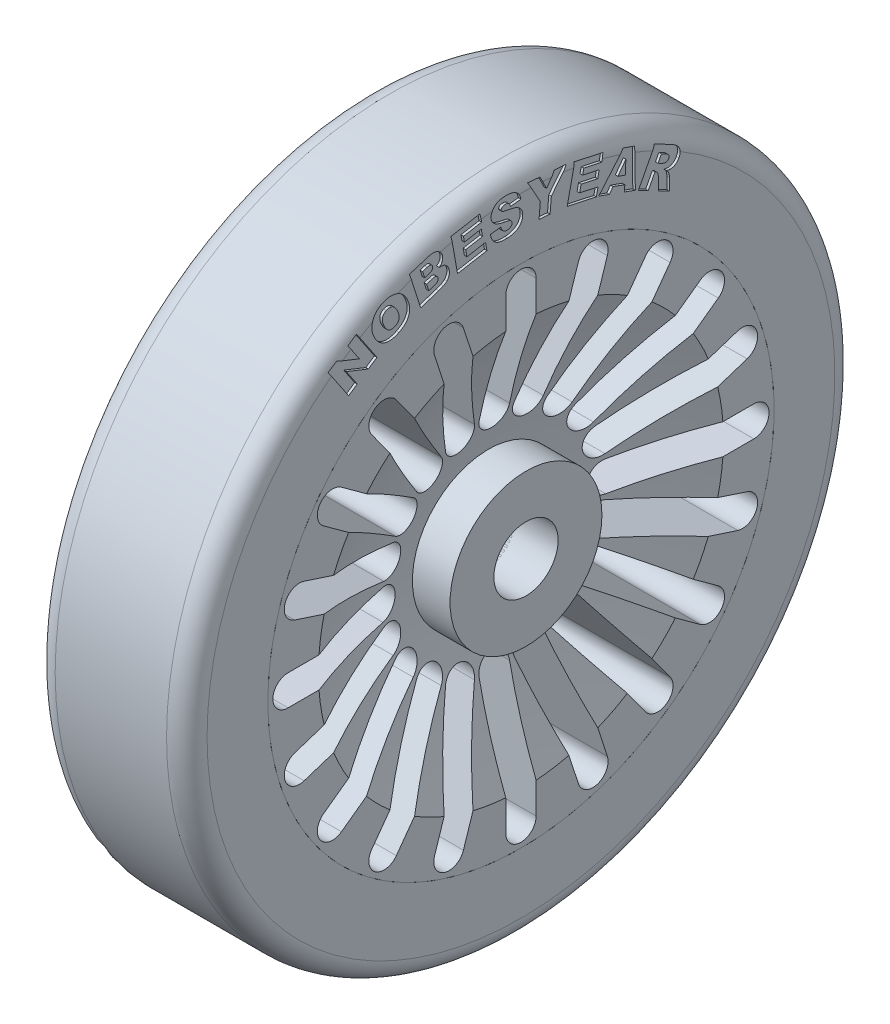
from build123d import *

# Parameters (mm, degrees)
SKETCH2_W           = 15
SKETCH2_H           = 8
FILLET1_R           = 2
SKETCH3_R           = 7.5
BOSS_EXTRUDE1_DEPTH = 8
SKETCH4_R           = 3.175
AXEL_HOLE_DEPTH     = 50.335585601
SPOKE_HOLE_DEPTH    = 48.349762477
CIRPATTERN1_COUNT   = 20
NAME_PLATE_DEPTH    = 0.25


with BuildPart() as part:
    # Sketch1 → Hub (revolve)
    with BuildSketch(Plane.XY):
        with BuildLine():
            Line((-3.75, 0), (3.75, 0))
            ThreePointArc((3.75, 0), (4.695598013, 10.174262873), (7.5, 20))
            Line((7.5, 20), (7.5, 25))
            Line((7.5, 25), (-7.5, 25))
            Line((-7.5, 25), (-7.5, 20))
            ThreePointArc((-7.5, 20), (-4.695598013, 10.174262873), (-3.75, 0))
        make_face()
    revolve(axis=Axis((-3.75, 0, 0), (1, 0, 0)))


with BuildPart() as body_2:
    # Sketch2 → Tire (revolve)
    with BuildSketch(Plane.XY, mode=Mode.PRIVATE) as tire_sk:
        with Locations((0, 29)):
            Rectangle(SKETCH2_W, SKETCH2_H)
    revolve(tire_sk.sketch.rotate(Axis((-1.5, 0, 0), (1, 0, 0)), 90), axis=Axis((-1.5, 0, 0), (1, 0, 0)))

    # Fillet1
    fillet1_edges = [body_2.edges().sort_by_distance(p)[0] for p in [
        (-7.5, 0, -33),
        (7.5, 0, -33),
    ]]
    fillet(fillet1_edges, radius=FILLET1_R)

    # Sketch6 → NAME PLATE (cut)
    # profile 1 of 9: a face of its own
    with BuildSketch(Plane(origin=(7.5, 0, 0), x_dir=(0, 0, -1), z_dir=(1, 0, 0))):
        Polygon((-18.993375251, 25.131214643), (-18.148204796, 25.700816915), (-15.952892296, 24.825106688), (-17.045221842, 26.445135097), (-16.192949114, 27.019708961), (-14.218517296, 24.091441915), (-15.070790023, 23.516868052), (-17.252608205, 24.384765779), (-16.16809116, 22.776811233), (-17.018943432, 22.202947597), align=None)
    # profile 2 of 9: a face of its own
    with BuildSketch(Plane(origin=(7.5, 0, 0), x_dir=(0, 0, -1), z_dir=(1, 0, 0))):
        with BuildLine():
            add(Edge.make_bspline(
                [(-14.495635258, 25.957333021), (-14.524596303, 26.020589457), (-14.581028049, 26.143847135), (-14.646506245, 26.331312387), (-14.693395657, 26.51475838), (-14.721109606, 26.694119267), (-14.731891855, 26.869219222), (-14.722710466, 27.040354689), (-14.693900257, 27.206982002), (-14.647855675, 27.369175888), (-14.583050319, 27.524329118), (-14.501536683, 27.672316029), (-14.401762005, 27.810938369), (-14.286497521, 27.942670247), (-14.152224142, 28.064159328), (-14.001879046, 28.177684617), (-13.834955016, 28.283854344), (-13.714486379, 28.344500075), (-13.652595485, 28.375656885)],
                knots=[0, 0, 0, 0, 1.147556844, 2.236060119, 3.271688379, 4.267888835, 5.226584, 6.161657968, 7.089078349, 8.011532036, 8.938013924, 9.857799998, 10.793330865, 11.751062409, 12.741000169, 13.775500434, 14.857160916, 16, 16, 16, 16], degree=3))
            add(Edge.make_bspline(
                [(-13.652595485, 28.375656885), (-13.588153108, 28.405088211), (-13.462728641, 28.462370524), (-13.272346669, 28.52911549), (-13.087164353, 28.578079959), (-12.906739334, 28.608648541), (-12.731031041, 28.619467165), (-12.560273136, 28.611830028), (-12.394282375, 28.585714388), (-12.234008297, 28.539850106), (-12.080483536, 28.476470656), (-11.934075203, 28.396493705), (-11.796874794, 28.298122661), (-11.666519863, 28.184297125), (-11.546714091, 28.051469993), (-11.433955718, 27.902856338), (-11.329308463, 27.737239922), (-11.268814833, 27.617903324), (-11.237822758, 27.556764839)],
                knots=[0, 0, 0, 0, 1.171891098, 2.280856497, 3.333726478, 4.338475981, 5.304026371, 6.241353904, 7.161752559, 8.078207226, 8.993455259, 9.905200075, 10.832452066, 11.781835806, 12.763505498, 13.786834529, 14.866151835, 16, 16, 16, 16], degree=3))
            add(Edge.make_bspline(
                [(-11.237822758, 27.556764839), (-11.216776094, 27.511506839), (-11.175519812, 27.42279079), (-11.122557619, 27.289193645), (-11.077445765, 27.1594792), (-11.041636142, 27.03284113), (-11.014466268, 26.909801214), (-10.996624844, 26.789937684), (-10.987198814, 26.673669281), (-10.986240898, 26.560640539), (-10.994493385, 26.450568799), (-11.009144918, 26.342997438), (-11.031812155, 26.237765575), (-11.062771529, 26.135161842), (-11.100158883, 26.034768394), (-11.145984884, 25.937045079), (-11.199525925, 25.841869025), (-11.259887269, 25.748619972), (-11.327869571, 25.658113998), (-11.405463414, 25.57206071), (-11.490397415, 25.488695034), (-11.584949601, 25.410205663), (-11.686619175, 25.333597175), (-11.797397772, 25.26162547), (-11.916561746, 25.193124035), (-11.999918502, 25.151292423), (-12.042510258, 25.129918249)],
                knots=[0, 0, 0, 0, 1.233425831, 2.417797208, 3.550282353, 4.626511627, 5.668653415, 6.66251431, 7.619322052, 8.549713982, 9.453126324, 10.345192288, 11.231211845, 12.110579057, 12.991988033, 13.87678948, 14.77533758, 15.689094136, 16.620644563, 17.569673324, 18.550355677, 19.55953236, 20.6045941, 21.695218295, 22.822354601, 24, 24, 24, 24], degree=3))
            add(Edge.make_bspline(
                [(-12.042510258, 25.129918249), (-12.086354926, 25.109367108), (-12.172042812, 25.069202959), (-12.301128787, 25.017397873), (-12.4267267, 24.973324492), (-12.549097186, 24.936558274), (-12.668492046, 24.908998922), (-12.784658408, 24.888844936), (-12.897563495, 24.876495568), (-13.007740178, 24.872749446), (-13.115753601, 24.8779365), (-13.222332822, 24.890700222), (-13.327846714, 24.911183315), (-13.432055276, 24.94058221), (-13.53497105, 24.978373512), (-13.636760317, 25.023969669), (-13.73737554, 25.077581326), (-13.836568168, 25.139133283), (-13.93343685, 25.209291557), (-14.025935439, 25.289495668), (-14.114897383, 25.378331476), (-14.199280297, 25.476653015), (-14.279753146, 25.583761706), (-14.356498603, 25.699642031), (-14.428917054, 25.824838306), (-14.473107328, 25.912595131), (-14.495635258, 25.957333021)],
                knots=[0, 0, 0, 0, 1.180994642, 2.308078441, 3.391145699, 4.427187976, 5.423184236, 6.378293821, 7.30174956, 8.191565589, 9.064524542, 9.936986702, 10.80793764, 11.683700077, 12.575257229, 13.480014828, 14.402314169, 15.354205886, 16.325656927, 17.316600957, 18.337483392, 19.389814632, 20.474358926, 21.60355643, 22.77830781, 24, 24, 24, 24], degree=3))
        make_face()
        with BuildLine():
            add(Edge.make_bspline(
                [(-13.518362531, 26.422531885), (-13.499368051, 26.384429117), (-13.462669583, 26.310812293), (-13.402715461, 26.207795241), (-13.342434216, 26.114897637), (-13.278614782, 26.034613369), (-13.214834226, 25.963960621), (-13.148805142, 25.905059063), (-13.081684256, 25.856194906), (-13.011871168, 25.820065683), (-12.941599213, 25.792754907), (-12.870192167, 25.775077666), (-12.798075575, 25.764518833), (-12.724860101, 25.764416504), (-12.650778688, 25.771365384), (-12.576067899, 25.787326062), (-12.500295977, 25.811395635), (-12.4511576, 25.833708481), (-12.426032985, 25.845117112)],
                knots=[0, 0, 0, 0, 1.451753448, 2.804874346, 4.063503266, 5.224980128, 6.299380172, 7.305912841, 8.238015884, 9.122931422, 9.979200078, 10.803697263, 11.627046977, 12.458787784, 13.294399992, 14.160661689, 15.059540244, 16, 16, 16, 16], degree=3))
            add(Edge.make_bspline(
                [(-12.426032985, 25.845117112), (-12.400933697, 25.857938744), (-12.351907486, 25.882983119), (-12.284007342, 25.927063436), (-12.224297427, 25.976227262), (-12.171820897, 26.029213825), (-12.126631359, 26.086158142), (-12.089568526, 26.147904263), (-12.059436252, 26.213546744), (-12.037072522, 26.284284316), (-12.023204468, 26.361095947), (-12.021157297, 26.445169149), (-12.0286034, 26.536260885), (-12.046040844, 26.634889483), (-12.074215074, 26.740923145), (-12.11298955, 26.854331423), (-12.161466017, 26.975422575), (-12.199540919, 27.057415706), (-12.219356849, 27.100088703)],
                knots=[0, 0, 0, 0, 0.928673853, 1.813970169, 2.662310032, 3.47351134, 4.268177454, 5.052467934, 5.841712529, 6.643854069, 7.49194263, 8.405541969, 9.407495453, 10.500610212, 11.70257545, 13.020409, 14.449283786, 16, 16, 16, 16], degree=3))
            add(Edge.make_bspline(
                [(-12.219356849, 27.100088703), (-12.237111081, 27.13585639), (-12.271389087, 27.20491288), (-12.328754093, 27.300823053), (-12.38664695, 27.387616977), (-12.447651501, 27.46351576), (-12.510410215, 27.529575442), (-12.575019089, 27.585553654), (-12.642337829, 27.630767274), (-12.711622216, 27.665884314), (-12.782432534, 27.691170515), (-12.85366271, 27.709706561), (-12.926038024, 27.71772445), (-12.999159019, 27.718795239), (-13.073151912, 27.710475083), (-13.148313168, 27.695113727), (-13.223961634, 27.669667379), (-13.273506755, 27.647614189), (-13.298902303, 27.636310294)],
                knots=[0, 0, 0, 0, 1.397080101, 2.697335408, 3.90846876, 5.045935185, 6.100820458, 7.093921255, 8.03154869, 8.932010844, 9.804868264, 10.658960914, 11.501724501, 12.346928528, 13.213470536, 14.102383644, 15.027330889, 16, 16, 16, 16], degree=3))
            add(Edge.make_bspline(
                [(-13.298902303, 27.636310294), (-13.322603701, 27.624227659), (-13.369135279, 27.600506523), (-13.43319581, 27.557640624), (-13.490555379, 27.509970612), (-13.540400178, 27.4569165), (-13.58421278, 27.399719572), (-13.621423093, 27.337650763), (-13.651155434, 27.270554355), (-13.674204896, 27.198749537), (-13.689437902, 27.121597862), (-13.694048936, 27.03851107), (-13.688466454, 26.949788526), (-13.674172533, 26.855163046), (-13.649610207, 26.754752494), (-13.614959193, 26.648945164), (-13.571636416, 26.536886328), (-13.536577904, 26.461631884), (-13.518362531, 26.422531885)],
                knots=[0, 0, 0, 0, 0.910332452, 1.787202857, 2.633136858, 3.458903744, 4.274460508, 5.09611858, 5.930751315, 6.781913036, 7.673830934, 8.615915255, 9.622742753, 10.713052165, 11.888854681, 13.15787868, 14.523317198, 16, 16, 16, 16], degree=3))
        make_face(mode=Mode.SUBTRACT)
    # profile 3 of 9: a face of its own
    with BuildSketch(Plane(origin=(7.5, 0, 0), x_dir=(0, 0, -1), z_dir=(1, 0, 0))):
        with BuildLine():
            Line((-10.972093337, 29.516051209), (-9.033172883, 30.131818255))
            add(Edge.make_bspline(
                [(-9.033172883, 30.131818255), (-8.993777011, 30.143453979), (-8.917014662, 30.166126038), (-8.802688195, 30.190749367), (-8.692602855, 30.203770949), (-8.587377923, 30.209843413), (-8.486743225, 30.203739521), (-8.390727264, 30.189168033), (-8.29920465, 30.164169495), (-8.212880042, 30.129447201), (-8.132776766, 30.086388144), (-8.058344647, 30.038606835), (-7.991820964, 29.983074782), (-7.93175565, 29.921944297), (-7.879083333, 29.854108654), (-7.833490988, 29.780179792), (-7.793807083, 29.70080344), (-7.774484441, 29.64415019), (-7.764706974, 29.615483028)],
                knots=[0, 0, 0, 0, 1.279270881, 2.492642879, 3.636824276, 4.729372547, 5.770756104, 6.77091085, 7.749411328, 8.718867964, 9.662287293, 10.578544374, 11.468857279, 12.355314276, 13.243272782, 14.137455373, 15.05753212, 16, 16, 16, 16], degree=3))
            add(Edge.make_bspline(
                [(-7.764706974, 29.615483028), (-7.757353452, 29.59098234), (-7.742866387, 29.542713897), (-7.729818773, 29.469108451), (-7.722243821, 29.396446928), (-7.722466619, 29.324612817), (-7.728874146, 29.253543684), (-7.74171248, 29.183442271), (-7.760627604, 29.113785869), (-7.778906463, 29.069149765), (-7.788144474, 29.046590982)],
                knots=[0, 0, 0, 0, 1.053603469, 2.075688686, 3.075829499, 4.061439649, 5.031516672, 6.013448437, 6.996010376, 8, 8, 8, 8], degree=3))
            add(Edge.make_bspline(
                [(-7.788144474, 29.046590982), (-7.803064206, 29.016426018), (-7.833911088, 28.954059277), (-7.90075304, 28.868372959), (-7.982009048, 28.784482553), (-8.04553723, 28.73453776), (-8.078627428, 28.7085228)],
                knots=[0, 0, 0, 0, 0.894549398, 1.849500995, 2.879860327, 4, 4, 4, 4], degree=3))
            add(Edge.make_bspline(
                [(-8.078627428, 28.7085228), (-8.046914852, 28.710024375), (-7.985163504, 28.712948272), (-7.894732249, 28.711937213), (-7.809075222, 28.703920076), (-7.728244782, 28.690843134), (-7.652096636, 28.671226791), (-7.580337485, 28.647116739), (-7.513986946, 28.615089868), (-7.451666598, 28.578971054), (-7.39409235, 28.537037105), (-7.341286053, 28.489489689), (-7.29201646, 28.437922933), (-7.247784697, 28.380247902), (-7.207367606, 28.317813149), (-7.170991598, 28.250236574), (-7.139812495, 28.177285715), (-7.122343376, 28.126490157), (-7.113428565, 28.100568255)],
                knots=[0, 0, 0, 0, 1.22059454, 2.376765533, 3.473654745, 4.525662559, 5.521345012, 6.494342261, 7.430846902, 8.348809484, 9.260977018, 10.16355646, 11.077901442, 11.999197657, 12.953580485, 13.935056434, 14.946221559, 16, 16, 16, 16], degree=3))
            add(Edge.make_bspline(
                [(-7.113428565, 28.100568255), (-7.101375361, 28.057731257), (-7.077678836, 27.973513981), (-7.062571174, 27.844612762), (-7.063405047, 27.717496093), (-7.083054418, 27.593352818), (-7.117835612, 27.473817091), (-7.16726452, 27.36059997), (-7.231072845, 27.254113016), (-7.285059127, 27.191235383), (-7.312292201, 27.159517118)],
                knots=[0, 0, 0, 0, 1.057525373, 2.079088399, 3.076269033, 4.073783777, 5.0596339, 6.030890041, 7.00669366, 8, 8, 8, 8], degree=3))
            add(Edge.make_bspline(
                [(-7.312292201, 27.159517118), (-7.332648904, 27.139543141), (-7.376634455, 27.096384563), (-7.458853482, 27.039096396), (-7.557485472, 26.980069376), (-7.63110424, 26.944208864), (-7.670246746, 26.925142118)],
                knots=[0, 0, 0, 0, 0.794468545, 1.716640263, 2.785956023, 4, 4, 4, 4], degree=3))
            add(Edge.make_bspline(
                [(-7.670246746, 26.925142118), (-7.696949021, 26.912486591), (-7.748067676, 26.888258936), (-7.821993442, 26.855293725), (-7.888472572, 26.825051084), (-7.948548027, 26.799972619), (-8.000857307, 26.77655857), (-8.047068969, 26.758537239), (-8.085881805, 26.743134397), (-8.109840474, 26.735407876), (-8.120530837, 26.7319603)],
                knots=[0, 0, 0, 0, 1.446630275, 2.769419248, 3.962732965, 5.021979233, 5.956434204, 6.767851108, 7.450214908, 8, 8, 8, 8], degree=3))
            Line((-8.120530837, 26.7319603), (-9.908172883, 26.164488709))
            Line((-9.908172883, 26.164488709), (-10.972093337, 29.516051209))
        make_face()
        with BuildLine():
            Line((-9.509735383, 28.533096664), (-9.059451292, 28.675852346))
            add(Edge.make_bspline(
                [(-9.059451292, 28.675852346), (-9.040225884, 28.68233907), (-9.003171143, 28.694841479), (-8.950550547, 28.715145022), (-8.90334047, 28.737252621), (-8.861586812, 28.760549085), (-8.824912088, 28.784576596), (-8.793973451, 28.810144245), (-8.768995559, 28.837401853), (-8.742227268, 28.874228724), (-8.719429158, 28.925429091), (-8.707406831, 28.992306694), (-8.710480647, 29.064558069), (-8.723676894, 29.112362425), (-8.730616065, 29.137500073)],
                knots=[0, 0, 0, 0, 1.120953654, 2.160507993, 3.11423721, 3.99843588, 4.800136749, 5.533640066, 6.209358931, 6.83731205, 8.043184075, 9.266870723, 10.562799556, 12, 12, 12, 12], degree=3))
            add(Edge.make_bspline(
                [(-8.730616065, 29.137500073), (-8.738865225, 29.160461615), (-8.754689514, 29.204508531), (-8.793449264, 29.260933946), (-8.84084851, 29.306080706), (-8.888364866, 29.332753461), (-8.930671369, 29.348109176), (-8.966591748, 29.355035371), (-9.005909327, 29.357568744), (-9.048643903, 29.35666949), (-9.095284355, 29.352623504), (-9.145197265, 29.342853158), (-9.198770927, 29.330113862), (-9.235163773, 29.319266688), (-9.254053565, 29.313636437)],
                knots=[0, 0, 0, 0, 1.386527332, 2.659762711, 3.863298009, 5.090828397, 5.735661307, 6.424109439, 7.168657542, 7.978864769, 8.860198351, 9.834746752, 10.876120286, 12, 12, 12, 12], degree=3))
            Line((-9.254053565, 29.313636437), (-9.711439928, 29.168750073))
            Line((-9.711439928, 29.168750073), (-9.509735383, 28.533096664))
        make_face(mode=Mode.SUBTRACT)
        with BuildLine():
            Line((-9.092121746, 27.2163353), (-8.563712655, 27.383948937))
            add(Edge.make_bspline(
                [(-8.563712655, 27.383948937), (-8.542317621, 27.391046939), (-8.501055517, 27.404736027), (-8.443109487, 27.428298958), (-8.390528588, 27.452166404), (-8.344353054, 27.478564395), (-8.303566843, 27.506164352), (-8.268783067, 27.5351349), (-8.239420019, 27.565279417), (-8.209886249, 27.607588432), (-8.1822873, 27.663739409), (-8.167762136, 27.736394705), (-8.167948801, 27.812607248), (-8.181143595, 27.8623522), (-8.188002428, 27.8882103)],
                knots=[0, 0, 0, 0, 1.133131178, 2.185337813, 3.1439592, 4.034294013, 4.856444491, 5.616995985, 6.307426723, 6.964737626, 8.205324068, 9.421686987, 10.659757952, 12, 12, 12, 12], degree=3))
            add(Edge.make_bspline(
                [(-8.188002428, 27.8882103), (-8.196655563, 27.911692847), (-8.213380096, 27.95707925), (-8.255516282, 28.015530939), (-8.308547244, 28.062092904), (-8.361685263, 28.090244085), (-8.409766433, 28.105055754), (-8.450430228, 28.113055319), (-8.495534571, 28.115675412), (-8.544645838, 28.1128816), (-8.598137041, 28.107594814), (-8.655658263, 28.09636803), (-8.717545634, 28.08155263), (-8.759795305, 28.068828634), (-8.781752428, 28.062215982)],
                knots=[0, 0, 0, 0, 1.277628968, 2.469365164, 3.647187149, 4.868265973, 5.516742257, 6.221036158, 6.986902775, 7.824814305, 8.739889839, 9.739304934, 10.82511843, 12, 12, 12, 12], degree=3))
            Line((-8.781752428, 28.062215982), (-9.30732061, 27.895312573))
            Line((-9.30732061, 27.895312573), (-9.092121746, 27.2163353))
        make_face(mode=Mode.SUBTRACT)
    # profile 4 of 9: a face of its own
    with BuildSketch(Plane(origin=(7.5, 0, 0), x_dir=(0, 0, -1), z_dir=(1, 0, 0))):
        Polygon((-6.873120161, 30.717790475), (-4.017296297, 31.221341611), (-3.888034934, 30.484835929), (-5.676387206, 30.16949502), (-5.579796297, 29.621909793), (-3.920705388, 29.914523429), (-3.796415615, 29.210688202), (-5.455506524, 28.918074566), (-5.335478115, 28.238387066), (-3.495279252, 28.562960929), (-3.357495161, 27.781710929), (-6.265165615, 27.268926838), align=None)
    # profile 5 of 9: a face of its own
    with BuildSketch(Plane(origin=(7.5, 0, 0), x_dir=(0, 0, -1), z_dir=(1, 0, 0))):
        with BuildLine():
            Line((-3.011666543, 28.996198137), (-1.982547225, 29.111254955))
            add(Edge.make_bspline(
                [(-1.982547225, 29.111254955), (-1.974070123, 29.071992448), (-1.957987793, 28.997505603), (-1.923463422, 28.894507436), (-1.881029971, 28.806257579), (-1.843883831, 28.757301989), (-1.826297225, 28.734124274)],
                knots=[0, 0, 0, 0, 1.167882679, 2.215648025, 3.155209809, 4, 4, 4, 4], degree=3))
            add(Edge.make_bspline(
                [(-1.826297225, 28.734124274), (-1.81100651, 28.717920812), (-1.780810254, 28.685922056), (-1.729883926, 28.644113465), (-1.674251989, 28.610182679), (-1.614722888, 28.582731402), (-1.550886357, 28.563074755), (-1.483104552, 28.54943325), (-1.410930047, 28.543154069), (-1.361578982, 28.544039157), (-1.336240407, 28.544493592)],
                knots=[0, 0, 0, 0, 0.980712201, 1.936720183, 2.891760862, 3.843665298, 4.81658511, 5.82684459, 6.884225486, 8, 8, 8, 8], degree=3))
            add(Edge.make_bspline(
                [(-1.336240407, 28.544493592), (-1.299594653, 28.547315782), (-1.230131004, 28.552665369), (-1.13381727, 28.578814585), (-1.050472266, 28.615879717), (-0.983252938, 28.667798973), (-0.931551988, 28.727724882), (-0.893103036, 28.791203041), (-0.872058388, 28.859940291), (-0.870911142, 28.906576657), (-0.870331316, 28.930147001)],
                knots=[0, 0, 0, 0, 1.306717763, 2.4769414, 3.537240005, 4.535870782, 5.474467313, 6.343818816, 7.162954521, 8, 8, 8, 8], degree=3))
            add(Edge.make_bspline(
                [(-0.870331316, 28.930147001), (-0.872832149, 28.952408123), (-0.877857096, 28.997137614), (-0.904889402, 29.060769645), (-0.946350397, 29.119587133), (-0.982769382, 29.152410779), (-1.001723362, 29.169493592)],
                knots=[0, 0, 0, 0, 0.951977257, 1.91281726, 2.913741864, 4, 4, 4, 4], degree=3))
            add(Edge.make_bspline(
                [(-1.001723362, 29.169493592), (-1.013608999, 29.17807731), (-1.039590169, 29.196840716), (-1.086348715, 29.220473928), (-1.142975022, 29.242710866), (-1.208703095, 29.265541518), (-1.284698656, 29.286612147), (-1.370280881, 29.306898903), (-1.465710846, 29.326877489), (-1.532700379, 29.338719522), (-1.567774498, 29.344919728)],
                knots=[0, 0, 0, 0, 0.588585232, 1.286606049, 2.097669232, 3.033543426, 4.081817059, 5.265813536, 6.568445323, 8, 8, 8, 8], degree=3))
            add(Edge.make_bspline(
                [(-1.567774498, 29.344919728), (-1.62587659, 29.355557019), (-1.73849675, 29.376175441), (-1.900219846, 29.414088246), (-2.049754766, 29.454732592), (-2.186249081, 29.500217609), (-2.31022189, 29.54891695), (-2.421615376, 29.601570891), (-2.521233216, 29.657504009), (-2.580006114, 29.701096222), (-2.608257452, 29.72205041)],
                knots=[0, 0, 0, 0, 1.269179615, 2.460069949, 3.568456884, 4.59810589, 5.550403483, 6.428828684, 7.244759161, 8, 8, 8, 8], degree=3))
            add(Edge.make_bspline(
                [(-2.608257452, 29.72205041), (-2.6338282, 29.743310645), (-2.684145145, 29.785145561), (-2.750370102, 29.855938187), (-2.807262081, 29.931834228), (-2.85382164, 30.013278928), (-2.892899683, 30.098810231), (-2.921365042, 30.189933042), (-2.93970972, 30.286038622), (-2.945040487, 30.351949821), (-2.947746089, 30.385402683)],
                knots=[0, 0, 0, 0, 1.035814183, 2.038227726, 3.01385107, 3.985979199, 4.957098373, 5.939730276, 6.95432157, 8, 8, 8, 8], degree=3))
            add(Edge.make_bspline(
                [(-2.947746089, 30.385402683), (-2.948290232, 30.430247989), (-2.949375287, 30.519672407), (-2.924266304, 30.652295819), (-2.881060875, 30.781751183), (-2.829627744, 30.885930541), (-2.77774403, 30.965706157), (-2.734035618, 31.024014552), (-2.684496956, 31.078757767), (-2.630646976, 31.131121669), (-2.570322527, 31.178785808), (-2.506632437, 31.225738116), (-2.436563297, 31.267839745), (-2.361758701, 31.308166272), (-2.280105801, 31.344462624), (-2.19141035, 31.377089141), (-2.094958016, 31.405181189), (-1.991518396, 31.43036964), (-1.880078805, 31.449444578), (-1.761758433, 31.466845244), (-1.635683758, 31.479607157), (-1.549095738, 31.484466213), (-1.504564271, 31.486965183)],
                knots=[0, 0, 0, 0, 1.316125397, 2.624438466, 3.945397879, 5.32158219, 6.026437792, 6.742143739, 7.461968988, 8.195633488, 8.948052299, 9.720967213, 10.520969045, 11.349455066, 12.21893339, 13.146248361, 14.126516352, 15.171777512, 16.275215779, 17.449826113, 18.688467715, 20, 20, 20, 20], degree=3))
            add(Edge.make_bspline(
                [(-1.504564271, 31.486965183), (-1.450122759, 31.488991157), (-1.34431471, 31.492928674), (-1.190131464, 31.488671896), (-1.045512235, 31.475793444), (-0.910186737, 31.456144838), (-0.785100699, 31.425696121), (-0.668818832, 31.389550875), (-0.562798897, 31.342855682), (-0.465072246, 31.289128831), (-0.37709259, 31.225169369), (-0.297369609, 31.152521925), (-0.227503649, 31.068923397), (-0.165352131, 30.976197979), (-0.112234162, 30.873351413), (-0.067457458, 30.76107151), (-0.031050173, 30.639352355), (-0.014485165, 30.554133358), (-0.005984725, 30.510402683)],
                knots=[0, 0, 0, 0, 1.304710694, 2.535728524, 3.691402443, 4.781318336, 5.807390719, 6.772214376, 7.694051888, 8.577521148, 9.438463607, 10.293314968, 11.154444162, 12.041491448, 12.962194541, 13.92150306, 14.933405936, 16, 16, 16, 16], degree=3))
            Line((-0.005984725, 30.510402683), (-1.026581316, 30.400317455))
            add(Edge.make_bspline(
                [(-1.026581316, 30.400317455), (-1.035848043, 30.43715853), (-1.053374741, 30.506838189), (-1.09601354, 30.600448923), (-1.147579649, 30.678936641), (-1.21290032, 30.739274514), (-1.288545123, 30.784574029), (-1.37607169, 30.813186727), (-1.474619828, 30.829102064), (-1.544039714, 30.827832114), (-1.580558589, 30.827164046)],
                knots=[0, 0, 0, 0, 1.170341321, 2.213534329, 3.160037379, 4.049298802, 4.934045414, 5.860679878, 6.874593898, 8, 8, 8, 8], degree=3))
            add(Edge.make_bspline(
                [(-1.580558589, 30.827164046), (-1.610270561, 30.824962671), (-1.66630179, 30.820811287), (-1.743818006, 30.801700764), (-1.809547874, 30.773284641), (-1.86271476, 30.735577133), (-1.903165799, 30.690832792), (-1.931832186, 30.6418481), (-1.94738337, 30.588286635), (-1.948095281, 30.551689617), (-1.948456316, 30.533129955)],
                knots=[0, 0, 0, 0, 1.353945565, 2.553288448, 3.614351042, 4.594972503, 5.495056103, 6.339588046, 7.157945502, 8, 8, 8, 8], degree=3))
            add(Edge.make_bspline(
                [(-1.948456316, 30.533129955), (-1.946716658, 30.519487201), (-1.943212584, 30.492007538), (-1.926063238, 30.452502766), (-1.898241703, 30.416568745), (-1.874309664, 30.396563037), (-1.861808589, 30.38611291)],
                knots=[0, 0, 0, 0, 0.933221435, 1.87972389, 2.892458343, 4, 4, 4, 4], degree=3))
            add(Edge.make_bspline(
                [(-1.861808589, 30.38611291), (-1.854130042, 30.380455169), (-1.837400676, 30.368128561), (-1.807034677, 30.35297863), (-1.770510575, 30.337969212), (-1.727199696, 30.324124214), (-1.677431257, 30.310634534), (-1.62115242, 30.298245606), (-1.55858267, 30.284926824), (-1.514313533, 30.278160105), (-1.491069952, 30.274607228)],
                knots=[0, 0, 0, 0, 0.585439607, 1.275506188, 2.078241647, 3.012558428, 4.068225543, 5.24748728, 6.554788863, 8, 8, 8, 8], degree=3))
            add(Edge.make_bspline(
                [(-1.491069952, 30.274607228), (-1.433253685, 30.264948101), (-1.321442286, 30.24626823), (-1.160585209, 30.214647189), (-1.012015362, 30.183698455), (-0.876130311, 30.152172526), (-0.753427561, 30.118442696), (-0.642686988, 30.085661917), (-0.545005525, 30.050749492), (-0.457946474, 30.015860906), (-0.38051275, 29.978162563), (-0.308649946, 29.939366177), (-0.243164825, 29.89631529), (-0.181167491, 29.852576715), (-0.125414228, 29.804956718), (-0.074491932, 29.754987098), (-0.028845514, 29.702279761), (0.024684115, 29.628848453), (0.080432865, 29.530869685), (0.131495642, 29.405717733), (0.164858531, 29.272169007), (0.172604779, 29.180092281), (0.176543684, 29.133272001)],
                knots=[0, 0, 0, 0, 1.586058795, 3.067293336, 4.435502218, 5.692554233, 6.840968207, 7.878547516, 8.816653854, 9.6469951, 10.414864224, 11.145966122, 11.854954902, 12.53411506, 13.197688365, 13.836398904, 14.4631432, 15.082013553, 16.292939842, 17.502747273, 18.730166912, 20, 20, 20, 20], degree=3))
            add(Edge.make_bspline(
                [(0.176543684, 29.133272001), (0.177484524, 29.105333439), (0.179351808, 29.049883841), (0.173901836, 28.967266082), (0.163213868, 28.885900221), (0.147260209, 28.805728078), (0.123950147, 28.727119258), (0.09582572, 28.649867081), (0.061363099, 28.57391147), (0.021044463, 28.499995485), (-0.024090224, 28.428273233), (-0.074713799, 28.360625242), (-0.130241989, 28.297189252), (-0.191018739, 28.238079849), (-0.256289184, 28.182819293), (-0.326231145, 28.1310748), (-0.401777666, 28.084757965), (-0.481554117, 28.040878441), (-0.566747977, 28.001900289), (-0.65782854, 27.967922402), (-0.753938028, 27.937286302), (-0.856243867, 27.911847276), (-0.964113449, 27.890653317), (-1.077650247, 27.873820291), (-1.196817089, 27.860797104), (-1.278210774, 27.855933742), (-1.31990518, 27.853442455)],
                knots=[0, 0, 0, 0, 0.907841004, 1.801789935, 2.686289387, 3.573360791, 4.454609566, 5.347763817, 6.242870393, 7.161918535, 8.08170682, 8.994034228, 9.904381242, 10.818263975, 11.746091092, 12.681540138, 13.64208207, 14.623135022, 15.638569274, 16.682961011, 17.780182393, 18.914527289, 20.106337836, 21.350901325, 22.642983246, 24, 24, 24, 24], degree=3))
            add(Edge.make_bspline(
                [(-1.31990518, 27.853442455), (-1.391868328, 27.850942767), (-1.530129981, 27.846140154), (-1.729604439, 27.852668179), (-1.912501901, 27.869440395), (-2.078804105, 27.899226358), (-2.228877604, 27.93952772), (-2.362116198, 27.993011553), (-2.479339236, 28.057211232), (-2.579325771, 28.134803733), (-2.665238435, 28.221271163), (-2.742537556, 28.313048219), (-2.810164818, 28.411743932), (-2.869224197, 28.516240688), (-2.919414431, 28.62715835), (-2.95952692, 28.744486893), (-2.991198528, 28.86800869), (-3.004765647, 28.952978408), (-3.011666543, 28.996198137)],
                knots=[0, 0, 0, 0, 1.500405067, 2.882704403, 4.156788487, 5.324994039, 6.399978045, 7.389547468, 8.310678103, 9.176211009, 10.017074736, 10.847214878, 11.673887025, 12.506852549, 13.346035243, 14.207394979, 15.088193946, 16, 16, 16, 16], degree=3))
        make_face()
    # profile 6 of 9: a face of its own
    with BuildSketch(Plane(origin=(7.5, 0, 0), x_dir=(0, 0, -1), z_dir=(1, 0, 0))):
        Polygon((0.71559655, 31.510405635), (1.920852232, 31.409553362), (2.530937459, 30.163104499), (3.339886323, 31.290235181), (4.538749959, 31.190093135), (3.001107914, 29.26182609), (2.877528369, 27.790235181), (1.789460187, 27.881854499), (1.913039732, 29.353445408), align=None)
    # profile 7 of 9: a face of its own
    with BuildSketch(Plane(origin=(7.5, 0, 0), x_dir=(0, 0, -1), z_dir=(1, 0, 0))):
        Polygon((5.310172541, 31.02069381), (8.139007768, 30.404216537), (7.979916859, 29.674813128), (6.209320268, 30.061176764), (6.090712314, 29.518563128), (7.733467996, 29.159898355), (7.581479359, 28.463165401), (5.938723678, 28.821830173), (5.791706632, 28.147824492), (7.614149814, 27.750097219), (7.44582595, 26.976659719), (4.565144132, 27.604500628), align=None)
    # profile 8 of 9: a face of its own
    with BuildSketch(Plane(origin=(7.5, 0, 0), x_dir=(0, 0, -1), z_dir=(1, 0, 0))):
        Polygon((10.258100668, 26.61670127), (9.090487032, 27.037155816), (8.731822259, 26.547098997), (7.683526805, 26.924939906), (10.126708623, 29.794258088), (11.24460635, 29.391559225), (11.297163168, 25.623803543), (10.224009759, 26.010167179), align=None)
        Polygon((10.301424532, 27.412155816), (10.364634759, 28.737439906), (9.570600668, 27.674939906), align=None, mode=Mode.SUBTRACT)
    # profile 9 of 9: a face of its own
    with BuildSketch(Plane(origin=(7.5, 0, 0), x_dir=(0, 0, -1), z_dir=(1, 0, 0))):
        with BuildLine():
            Line((11.60044499, 25.458607427), (13.233967717, 28.582186973))
            Line((13.233967717, 28.582186973), (14.84263249, 27.741277882))
            add(Edge.make_bspline(
                [(14.84263249, 27.741277882), (14.878706648, 27.72202833), (14.948642221, 27.684709969), (15.048781116, 27.627818772), (15.141372594, 27.572545804), (15.22595666, 27.518172993), (15.302229231, 27.463786927), (15.371033155, 27.411100752), (15.431632545, 27.358815514), (15.485754215, 27.308166802), (15.533542463, 27.256595797), (15.574784968, 27.201985066), (15.611712428, 27.145340674), (15.644093795, 27.086208789), (15.670359544, 27.023992494), (15.691327697, 26.959230626), (15.708983314, 26.8922744), (15.71976131, 26.82277442), (15.72661468, 26.751856277), (15.726521958, 26.680045959), (15.719892976, 26.607872234), (15.707686058, 26.535260667), (15.690169291, 26.461981219), (15.665421595, 26.388658762), (15.635900962, 26.314363616), (15.611479206, 26.26596191), (15.599024535, 26.241277882)],
                knots=[0, 0, 0, 0, 1.525754858, 2.957921776, 4.297245312, 5.54941349, 6.70886425, 7.792067532, 8.781904698, 9.694279924, 10.557152928, 11.40174265, 12.244667425, 13.078749925, 13.913954509, 14.760436432, 15.617501222, 16.494726528, 17.381728329, 18.273993762, 19.169794661, 20.083323954, 21.019677596, 21.977905161, 22.9687668, 24, 24, 24, 24], degree=3))
            add(Edge.make_bspline(
                [(15.599024535, 26.241277882), (15.575966315, 26.199852066), (15.53129615, 26.119598776), (15.447857801, 26.01364243), (15.357318734, 25.922015861), (15.255749075, 25.848857297), (15.147942922, 25.789797112), (15.033399095, 25.747087292), (14.913743576, 25.715655785), (14.831222174, 25.708152102), (14.789365444, 25.704346064)],
                knots=[0, 0, 0, 0, 1.114942872, 2.159953403, 3.165301118, 4.138869555, 5.096907536, 6.051630046, 7.011742476, 8, 8, 8, 8], degree=3))
            add(Edge.make_bspline(
                [(14.789365444, 25.704346064), (14.760697961, 25.703456354), (14.69989924, 25.701569436), (14.603771133, 25.71256978), (14.497641324, 25.729889386), (14.424432819, 25.74806204), (14.385956353, 25.757613109)],
                knots=[0, 0, 0, 0, 0.84164753, 1.784987298, 2.835847533, 4, 4, 4, 4], degree=3))
            add(Edge.make_bspline(
                [(14.385956353, 25.757613109), (14.407982552, 25.734154349), (14.449227405, 25.690226973), (14.503233769, 25.625692888), (14.546550831, 25.567770537), (14.567451669, 25.528924551), (14.57700749, 25.511164245)],
                knots=[0, 0, 0, 0, 1.233744432, 2.310231042, 3.227441113, 4, 4, 4, 4], degree=3))
            add(Edge.make_bspline(
                [(14.57700749, 25.511164245), (14.582971584, 25.498014014), (14.596830896, 25.467455616), (14.612607918, 25.412584576), (14.629626166, 25.344086201), (14.646158089, 25.266095356), (14.661470599, 25.187091938), (14.671892814, 25.115259846), (14.679321182, 25.054881791), (14.67978377, 25.018282869), (14.679990444, 25.001931291)],
                knots=[0, 0, 0, 0, 0.663268478, 1.541297811, 2.618559156, 3.910379512, 5.206413133, 6.318002118, 7.248521038, 8, 8, 8, 8], degree=3))
            Line((14.679990444, 25.001931291), (14.672888171, 23.852073336))
            Line((14.672888171, 23.852073336), (13.581979081, 24.422385836))
            Line((13.581979081, 24.422385836), (13.565643853, 25.646817655))
            add(Edge.make_bspline(
                [(13.565643853, 25.646817655), (13.56495111, 25.683304034), (13.563670976, 25.750727921), (13.555005434, 25.84292938), (13.540688394, 25.918202873), (13.52404001, 25.960429946), (13.516638171, 25.979204018)],
                knots=[0, 0, 0, 0, 1.294459479, 2.392056692, 3.285111633, 4, 4, 4, 4], degree=3))
            add(Edge.make_bspline(
                [(13.516638171, 25.979204018), (13.504650508, 25.999467467), (13.480762994, 26.039845928), (13.434968447, 26.093631806), (13.379905075, 26.138974123), (13.33873579, 26.162996038), (13.317774535, 26.175226745)],
                knots=[0, 0, 0, 0, 0.995639265, 1.983985112, 2.973550263, 4, 4, 4, 4], degree=3))
            Line((13.317774535, 26.175226745), (13.232547262, 26.219971064))
            Line((13.232547262, 26.219971064), (12.569905217, 24.952215382))
            Line((12.569905217, 24.952215382), (11.60044499, 25.458607427))
        make_face()
        with BuildLine():
            Line((13.541496126, 26.810169927), (13.948456353, 26.597101745))
            add(Edge.make_bspline(
                [(13.948456353, 26.597101745), (13.962338104, 26.590733464), (13.995627189, 26.575462028), (14.056510394, 26.55515723), (14.135140241, 26.53108294), (14.193904622, 26.515012373), (14.226155217, 26.506192655)],
                knots=[0, 0, 0, 0, 0.626100958, 1.501419323, 2.628749078, 4, 4, 4, 4], degree=3))
            add(Edge.make_bspline(
                [(14.226155217, 26.506192655), (14.243571958, 26.501928591), (14.278059847, 26.493485074), (14.331174158, 26.493399792), (14.383654505, 26.501891775), (14.434404465, 26.520714259), (14.482421913, 26.547171071), (14.524904784, 26.582060449), (14.561763545, 26.623370984), (14.580375771, 26.655448031), (14.589791581, 26.671675609)],
                knots=[0, 0, 0, 0, 0.991331902, 1.962993261, 2.921346621, 3.926407502, 4.949150106, 5.947758572, 6.96178386, 8, 8, 8, 8], degree=3))
            add(Edge.make_bspline(
                [(14.589791581, 26.671675609), (14.60129822, 26.696137995), (14.62321131, 26.742723837), (14.637765807, 26.816392482), (14.635879437, 26.88736295), (14.620256293, 26.944144763), (14.598490289, 26.988066882), (14.574642135, 27.021223482), (14.544544109, 27.054678843), (14.507749788, 27.08821648), (14.464489276, 27.122069043), (14.414575023, 27.156057725), (14.358388699, 27.190197627), (14.318124885, 27.211651013), (14.297177944, 27.222811973)],
                knots=[0, 0, 0, 0, 1.355578765, 2.581546157, 3.737085788, 4.898377757, 5.510754009, 6.194556734, 6.94508108, 7.770887091, 8.695125532, 9.705755923, 10.806437089, 12, 12, 12, 12], degree=3))
            Line((14.297177944, 27.222811973), (13.873172262, 27.445113109))
            Line((13.873172262, 27.445113109), (13.541496126, 26.810169927))
        make_face(mode=Mode.SUBTRACT)
    extrude(amount=-NAME_PLATE_DEPTH, mode=Mode.SUBTRACT)


with BuildPart() as body_3:
    # Sketch3 → Boss-Extrude1 (new, symmetric)
    with BuildSketch(Plane(origin=(0, 0, 0), x_dir=(0, 0, -1), z_dir=(1, 0, 0))):
        Circle(SKETCH3_R)
    extrude(amount=BOSS_EXTRUDE1_DEPTH, both=True)


with BuildPart() as axel_hole_tool:
    # Sketch4 → AXEL HOLE (new, through all)
    with BuildSketch(Plane(origin=(8, 0, 0), x_dir=(0, 0, -1), z_dir=(1, 0, 0))):
        Circle(SKETCH4_R)
    extrude(amount=-AXEL_HOLE_DEPTH)


with BuildPart() as part_1:
    add(part.part)

    # AXEL HOLE: cut by axel_hole_tool
    add(axel_hole_tool.part, mode=Mode.SUBTRACT)

    # Sketch5 → SPOKE Hole (cut, symmetric)
    with BuildSketch(Plane(origin=(0, 0, 0), x_dir=(0, 0, -1), z_dir=(1, 0, 0))):
        with BuildLine():
            Line((-1.5, 11), (-1.5, 23))
            ThreePointArc((-1.5, 23), (0, 24.5), (1.5, 23))
            Line((1.5, 23), (1.5, 11))
            ThreePointArc((1.5, 11), (0, 9.5), (-1.5, 11))
        make_face()
    spoke_hole = extrude(amount=SPOKE_HOLE_DEPTH, both=True, mode=Mode.SUBTRACT)

    # CirPattern1: SPOKE Hole ×20 about axis
    cirpattern1_axis = Axis((0, 0, 0), (1, 0, 0))
    for i in range(1, CIRPATTERN1_COUNT):
        add(spoke_hole.rotate(cirpattern1_axis, i * 360 / CIRPATTERN1_COUNT), mode=Mode.SUBTRACT)


with BuildPart() as body_3_1:
    add(body_3.part)

    # AXEL HOLE: cut by axel_hole_tool
    add(axel_hole_tool.part, mode=Mode.SUBTRACT)


solid = Compound([body_2.part, part_1.part, body_3_1.part])
